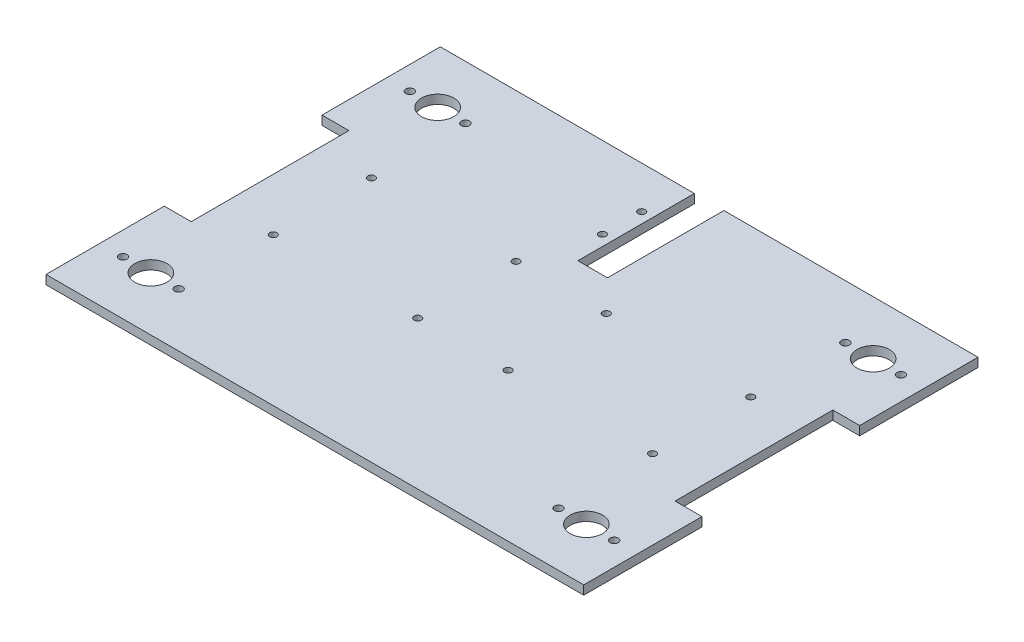
from build123d import *

# Parameters (mm, degrees)
SKETCH1_W               = 300
SKETCH1_H               = 220
BOSS_EXTRUDE1_DEPTH     = 5
SKETCH2_W               = 15
SKETCH2_H               = 88
CUT_EXTRUDE1_DEPTH      = 10
ESQUISSE2_R             = 2
ENL_V_MAT_EXTRU_1_DEPTH = 10
ESQUISSE4_W             = 16.5
ESQUISSE4_H             = 65
ENL_V_MAT_EXTRU_4_DEPTH = 5
ESQUISSE5_R             = 2
ENL_V_MAT_EXTRU_5_DEPTH = 10
ESQUISSE6_R             = 2.25
ENL_V_MAT_EXTRU_6_DEPTH = 10
ESQUISSE7_R             = 9
ENL_V_MAT_EXTRU_9_DEPTH = 10


with BuildPart() as part:
    # Sketch1 → Boss-Extrude1 (new body)
    with BuildSketch(Plane(origin=(0, 0, 0), x_dir=(1, 0, 0), z_dir=(0, 1, 0))):
        Rectangle(SKETCH1_W, SKETCH1_H)
    extrude(amount=BOSS_EXTRUDE1_DEPTH)

    # Sketch2 → Cut-Extrude1 (cut)
    with BuildSketch(Plane(origin=(0, 5, 0), x_dir=(1, 0, 0), z_dir=(0, 1, 0))):
        with Locations((-142.5, 0)):
            Rectangle(SKETCH2_W, SKETCH2_H)
        with Locations((142.5, 0)):
            Rectangle(SKETCH2_W, SKETCH2_H)
    extrude(amount=-CUT_EXTRUDE1_DEPTH, mode=Mode.SUBTRACT)

    # Esquisse2 → Enlèv. mat.-Extru.1 (cut)
    with BuildSketch(Plane(origin=(0, 5, 0), x_dir=(1, 0, 0), z_dir=(0, 1, 0))):
        with Locations(Location((-105.8, 27.4, 0), (0, 0, 270))):
            Circle(ESQUISSE2_R)
        with Locations(Location((-25.2, 27.4, 0), (0, 0, 270))):
            Circle(ESQUISSE2_R)
        with Locations(Location((-25.2, -27.4, 0), (0, 0, 90))):
            Circle(ESQUISSE2_R)
        with Locations(Location((-105.8, -27.4, 0), (0, 0, 90))):
            Circle(ESQUISSE2_R)
        with Locations(Location((25.2, -27.4, 0), (0, 0, 270))):
            Circle(ESQUISSE2_R)
        with Locations(Location((105.8, -27.4, 0), (0, 0, 270))):
            Circle(ESQUISSE2_R)
        with Locations(Location((25.2, 27.4, 0), (0, 0, 90))):
            Circle(ESQUISSE2_R)
        with Locations(Location((105.8, 27.4, 0), (0, 0, 90))):
            Circle(ESQUISSE2_R)
    extrude(amount=-ENL_V_MAT_EXTRU_1_DEPTH, mode=Mode.SUBTRACT)

    # Esquisse4 → Enlèv. mat.-Extru.4 (cut)
    with BuildSketch(Plane(origin=(0, 5, 0), x_dir=(1, 0, 0), z_dir=(0, 1, 0))):
        with Locations((0, 77.5)):
            Rectangle(ESQUISSE4_W, ESQUISSE4_H)
    extrude(amount=-ENL_V_MAT_EXTRU_4_DEPTH, mode=Mode.SUBTRACT)

    # Esquisse5 → Enlèv. mat.-Extru.5 (cut)
    with BuildSketch(Plane(origin=(0, 5, 0), x_dir=(1, 0, 0), z_dir=(0, 1, 0))):
        with Locations(Location((-14.16612842, 86.53761558, 0), (0, 0, 270))):
            Circle(ESQUISSE5_R)
        with Locations(Location((-14.16612842, 64.64560566, 0), (0, 0, 270))):
            Circle(ESQUISSE5_R)
    extrude(amount=-ENL_V_MAT_EXTRU_5_DEPTH, mode=Mode.SUBTRACT)

    # Esquisse6 → Enlèv. mat.-Extru.6 (cut)
    with BuildSketch(Plane(origin=(0, 5, 0), x_dir=(1, 0, 0), z_dir=(0, 1, 0))):
        with Locations(Location((-137, -80, 0), (0, 0, 270))):
            Circle(ESQUISSE6_R)
        with Locations(Location((-106, -80, 0), (0, 0, 270))):
            Circle(ESQUISSE6_R)
        with Locations(Location((106, -80, 0), (0, 0, 90))):
            Circle(ESQUISSE6_R)
        with Locations(Location((137, -80, 0), (0, 0, 90))):
            Circle(ESQUISSE6_R)
        with Locations(Location((137, 80, 0), (0, 0, 270))):
            Circle(ESQUISSE6_R)
        with Locations(Location((106, 80, 0), (0, 0, 270))):
            Circle(ESQUISSE6_R)
        with Locations(Location((-106, 80, 0), (0, 0, 90))):
            Circle(ESQUISSE6_R)
        with Locations(Location((-137, 80, 0), (0, 0, 90))):
            Circle(ESQUISSE6_R)
    extrude(amount=-ENL_V_MAT_EXTRU_6_DEPTH, mode=Mode.SUBTRACT)

    # Esquisse7 → Enlèv. mat.-Extru.9 (cut)
    with BuildSketch(Plane(origin=(0, 5, 0), x_dir=(1, 0, 0), z_dir=(0, 1, 0))):
        with Locations(Location((-121.5, 80, 0), (0, 0, 270))):
            Circle(ESQUISSE7_R)
        with Locations(Location((-121.5, -80, 0), (0, 0, 90))):
            Circle(ESQUISSE7_R)
        with Locations(Location((121.5, -80, 0), (0, 0, 270))):
            Circle(ESQUISSE7_R)
        with Locations(Location((121.5, 80, 0), (0, 0, 90))):
            Circle(ESQUISSE7_R)
    extrude(amount=-ENL_V_MAT_EXTRU_9_DEPTH, mode=Mode.SUBTRACT)


solid = part.part
